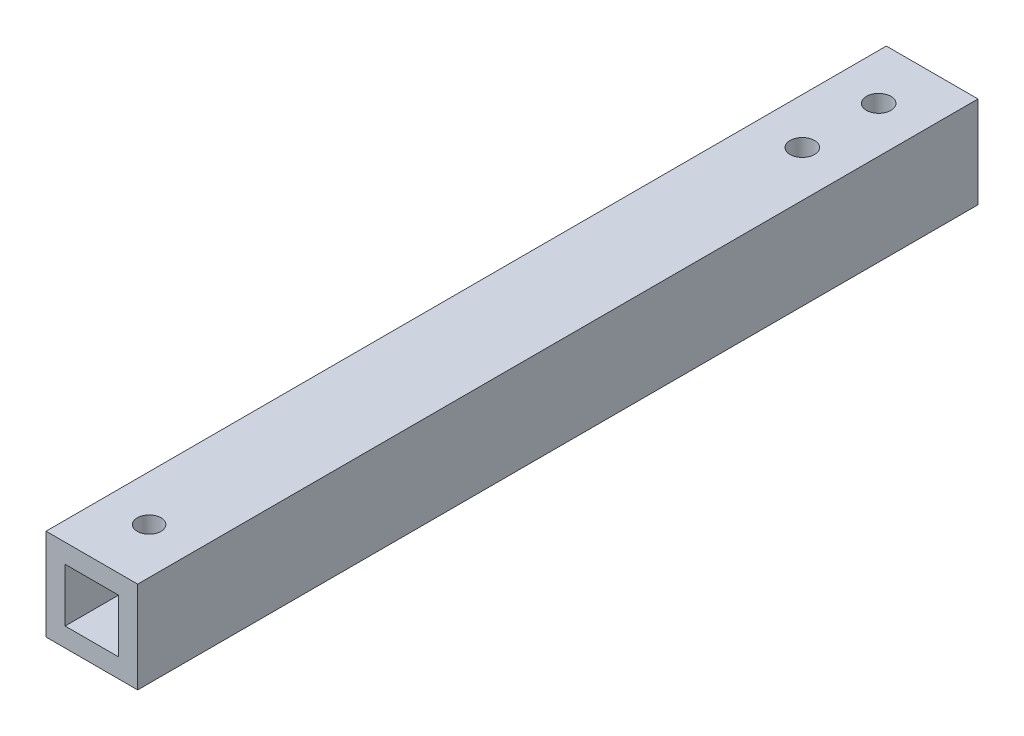
from build123d import *

# Parameters (mm, degrees)
SKETCH_1_W          = 12
SKETCH_1_H          = 12
EXTRUDE_1_DEPTH     = 110
SKETCH_2_W          = 7
SKETCH_2_H          = 7
CUT_EXTRUDE_1_DEPTH = 111.326787318
SKETCH_3_R          = 1.6
SKETCH_3_R_2        = 1.55
CUT_EXTRUDE_2_DEPTH = 111.815161418


with BuildPart() as part:
    # 草图1 → 凸台-拉伸1 (new body)
    with BuildSketch(Plane.XY):
        Rectangle(SKETCH_1_W, SKETCH_1_H)
    extrude(amount=EXTRUDE_1_DEPTH)

    # 草图2 → 切除-拉伸1 (cut, through all)
    with BuildSketch(Plane.XY.offset(110)):
        Rectangle(SKETCH_2_W, SKETCH_2_H)
    extrude(amount=-CUT_EXTRUDE_1_DEPTH, mode=Mode.SUBTRACT)

    # 草图3 → 切除-拉伸2 (cut, through all)
    with BuildSketch(Plane.XZ.offset(6)):
        with Locations(Location((0, 7, 0), (0, 0, 270))):
            Circle(SKETCH_3_R)
        with Locations(Location((0, 17, 0), (0, 0, 270))):
            Circle(SKETCH_3_R)
        with Locations(Location((0, 102.5, 0), (0, 0, 270))):
            Circle(SKETCH_3_R_2)
    extrude(amount=-CUT_EXTRUDE_2_DEPTH, mode=Mode.SUBTRACT)


solid = part.part
